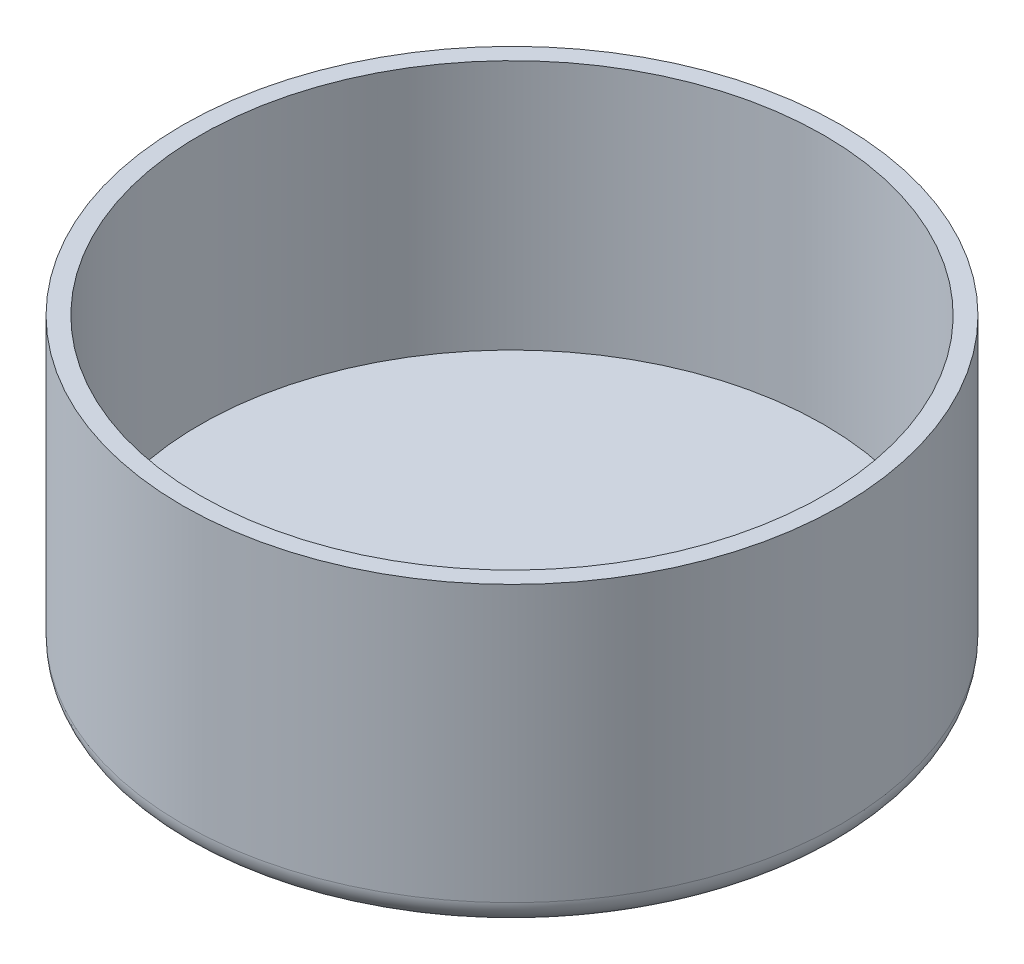
from build123d import *

# Parameters (mm, degrees)
SKETCH1_R           = 13.15
BOSS_EXTRUDE1_DEPTH = 2
SKETCH2_R           = 13.15
SKETCH2_R_2         = 12.45
BOSS_EXTRUDE2_DEPTH = 10
FILLET1_R           = 1


with BuildPart() as part:
    # Sketch1 → Boss-Extrude1 (new body)
    with BuildSketch(Plane(origin=(0, 0, 0), x_dir=(1, 0, 0), z_dir=(0, 1, 0))):
        with Locations(Location((0, 0, 0), (0, 0, 270))):
            Circle(SKETCH1_R)
    extrude(amount=BOSS_EXTRUDE1_DEPTH)

    # Sketch2 → Boss-Extrude2 (add)
    with BuildSketch(Plane(origin=(0, 2, 0), x_dir=(1, 0, 0), z_dir=(0, 1, 0))):
        with Locations(Location((0, 0, 0), (0, 0, 270))):
            Circle(SKETCH2_R)
        with Locations(Location((0, 0, 0), (0, 0, 270))):
            Circle(SKETCH2_R_2, mode=Mode.SUBTRACT)
    extrude(amount=BOSS_EXTRUDE2_DEPTH)

    # Fillet1
    fillet1_edges = [part.edges().sort_by_distance(p)[0] for p in [
        (0, 0, -13.15),
    ]]
    fillet(fillet1_edges, radius=FILLET1_R)


solid = part.part
